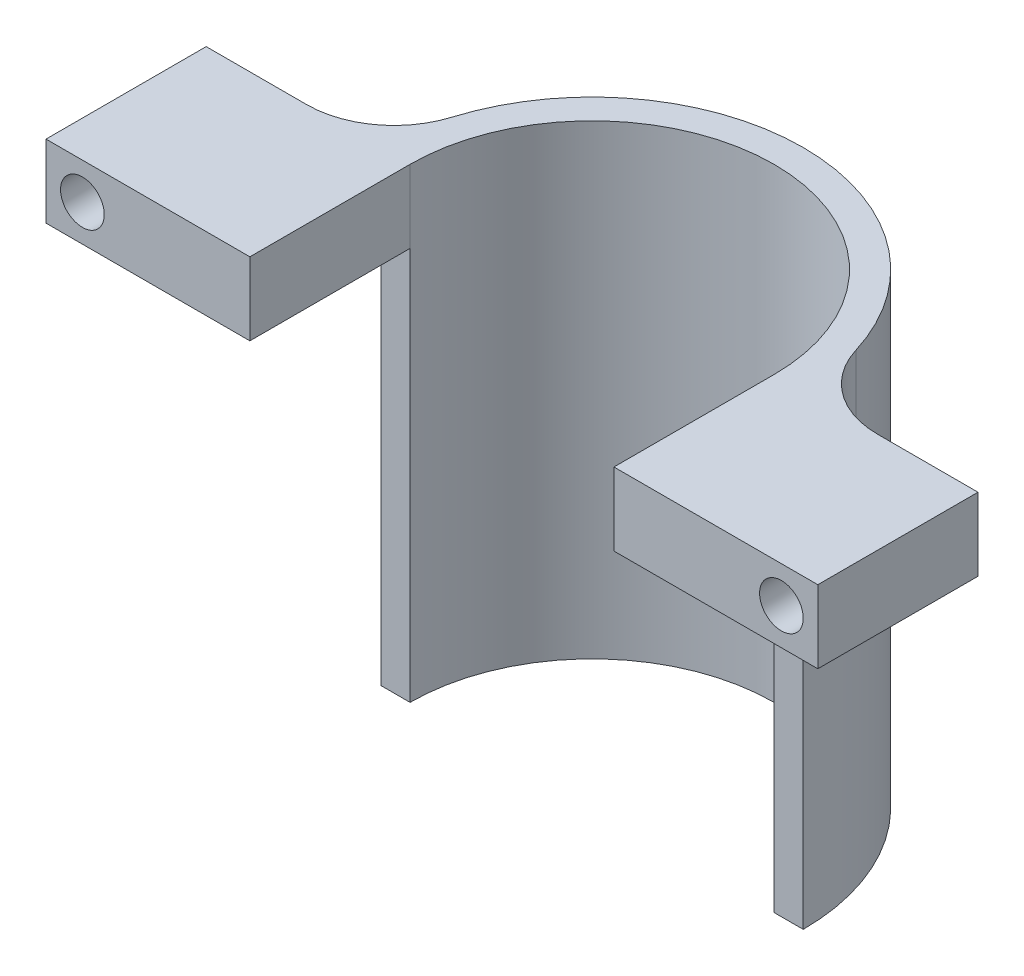
from build123d import *

# Parameters (mm, degrees)
BOSS_EXTRUDE1_DEPTH = 32
BOSS_EXTRUDE2_DEPTH = 11
SKETCH3_R           = 1.5
CUT_EXTRUDE1_DEPTH  = 45.005681451
FILLET1_R           = 6


with BuildPart() as part:
    # Sketch1 → Boss-Extrude1 (new body)
    with BuildSketch(Plane(origin=(0, 0, 0), x_dir=(1, 0, 0), z_dir=(0, 1, 0))):
        with BuildLine():
            Line((-14.5, 0), (-12.5, 0))
            ThreePointArc((-12.5, 0), (0, 12.5), (12.5, 0))
            Line((12.5, 0), (14.5, 0))
            ThreePointArc((14.5, 0), (0, 14.5), (-14.5, 0))
        make_face()
    extrude(amount=BOSS_EXTRUDE1_DEPTH)

    # Sketch2 → Boss-Extrude2 (add)
    with BuildSketch(Plane.XY):
        Polygon((-14.5, 32), (-12.5, 32), (-12.5, 27), (-14.5, 27), (-26.5, 27), (-26.5, 32), align=None)
        Polygon((12.5, 32), (12.5, 27), (14.5, 27), (26.5, 27), (26.5, 32), (14.5, 32), align=None)
    extrude(amount=BOSS_EXTRUDE2_DEPTH)

    # Sketch3 → Cut-Extrude1 (cut, through all)
    with BuildSketch(Plane(origin=(0, 0, 0), x_dir=(-1, 0, 0), z_dir=(0, 0, -1))):
        with Locations((24, 29.5)):
            Circle(SKETCH3_R)
        with Locations(Location((-24, 29.5, 0), (0, 0, 180))):
            Circle(SKETCH3_R)
    extrude(amount=-CUT_EXTRUDE1_DEPTH, mode=Mode.SUBTRACT)

    # Fillet1
    fillet1_edges = [part.edges().sort_by_distance(p)[0] for p in [
        (-14.5, 29.5, 0),
        (14.5, 29.5, 0),
    ]]
    fillet(fillet1_edges, radius=FILLET1_R)


solid = part.part
